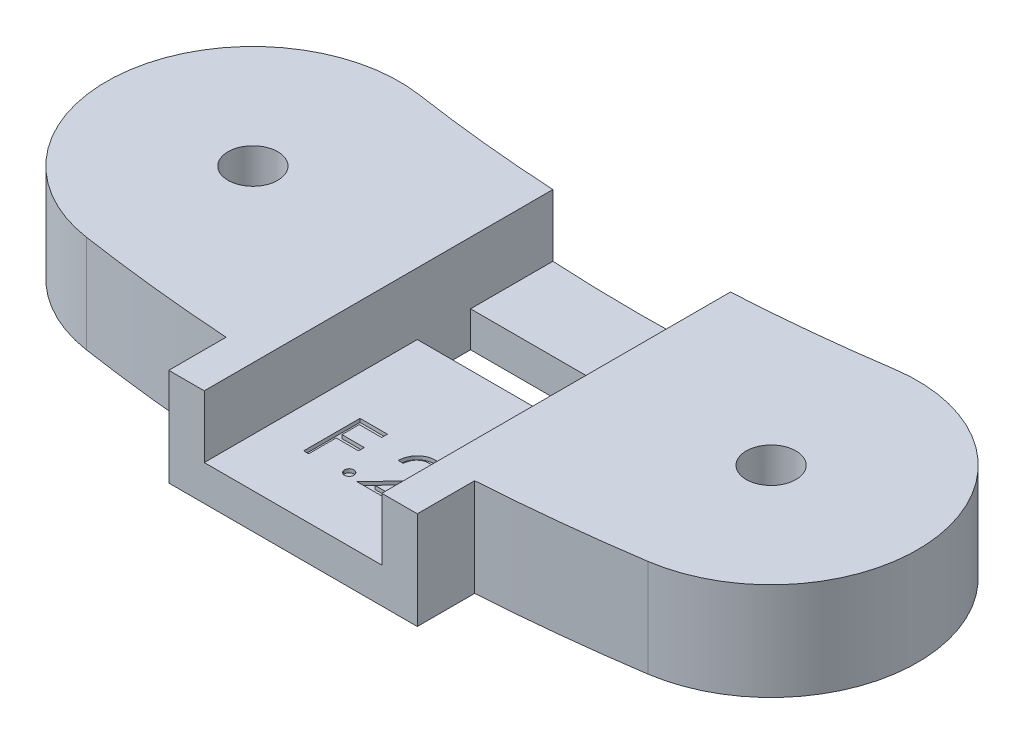
from build123d import *

# Parameters (mm, degrees)
SKETCH2_R                       = 1.4
BOSS_EXTRUDE1_DEPTH             = 14
BOSS_EXTRUDE2_REACH             = 34.049
BOSS_EXTRUDE2_END_RADIUS        = 107
SKETCH3_W                       = 14
SKETCH3_H                       = 14
BOSS_EXTRUDE2_DIRECTION_2_DEPTH = 3
SKETCH19_W                      = 15.846179349
SKETCH19_H                      = 3
CUT_EXTRUDE4_DEPTH              = 22
CUT_EXTRUDE8_DEPTH              = 34.788712692
SKETCH25_W                      = 10
SKETCH25_H                      = 3
CUT_EXTRUDE9_DEPTH              = 2
CUT_EXTRUDE10_DEPTH             = 0.2


with BuildPart() as part:
    # Sketch2 → Boss-Extrude1 (new body)
    with BuildSketch(Plane(origin=(0, 0, 0), x_dir=(1, 0, 0), z_dir=(0, 1, 0))):
        with BuildLine():
            ThreePointArc((-13.376751707, 9.244064366), (0, 8.25), (13.376751707, 9.244064366))
            ThreePointArc((13.376751707, 9.244064366), (22.755560222, 2.304111135), (15.815606991, -7.07469738))
            ThreePointArc((15.815606991, -7.07469738), (0, -8.25), (-15.815606991, -7.07469738))
            ThreePointArc((-15.815606991, -7.07469738), (-22.755560222, 2.304111135), (-13.376751707, 9.244064366))
        make_face()
        with Locations(Location((-14.596179349, 1.084683493, 0), (0, 0, 270))):
            Circle(SKETCH2_R, mode=Mode.SUBTRACT)
        with Locations(Location((14.596179349, 1.084683493, 0), (0, 0, 270))):
            Circle(SKETCH2_R, mode=Mode.SUBTRACT)
    extrude(amount=BOSS_EXTRUDE1_DEPTH)

    # Boss-Extrude2: up to this cylinder (the profile starts outside it)
    boss_extrude2_end = Plane(origin=(0, 7, -98.75), z_dir=(0, -1, 0)) * Cylinder(BOSS_EXTRUDE2_END_RADIUS, 283.098, mode=Mode.PRIVATE)
    # Sketch3 → Boss-Extrude2 (add, up to the surface)
    with BuildSketch(Plane.XY.offset(8.25), mode=Mode.PRIVATE) as boss_extrude2_sk1:
        with Locations((0, 7)):
            Rectangle(SKETCH3_W, SKETCH3_H)
    boss_extrude2_tool1 = extrude(boss_extrude2_sk1.sketch, amount=-BOSS_EXTRUDE2_REACH, mode=Mode.PRIVATE) - boss_extrude2_end
    add(boss_extrude2_tool1.solids().sort_by_distance((0, 7, 8.25))[0])
    add(boss_extrude2_tool1.solids().sort_by_distance((0, 7, 8.25))[1])

    # Sketch3 → Boss-Extrude2 direction 2 (add)
    with BuildSketch(Plane.XY.offset(8.25)):
        with Locations((0, 7)):
            Rectangle(SKETCH3_W, SKETCH3_H)
    extrude(amount=BOSS_EXTRUDE2_DIRECTION_2_DEPTH)

    # Sketch19 → Cut-Extrude4 (cut)
    with BuildSketch(Plane.XY.offset(8.25)):
        with Locations((-14.923089674, 7)):
            Rectangle(SKETCH19_W, SKETCH19_H)
    cut_extrude4 = extrude(amount=-CUT_EXTRUDE4_DEPTH, mode=Mode.SUBTRACT)

    # Mirror2: Cut-Extrude4 across plane
    add(cut_extrude4.mirror(Plane(origin=(0, 0, 0), x_dir=(0, 0, 1), z_dir=(1, 0, 0))), mode=Mode.SUBTRACT)

    # Sketch24 → Cut-Extrude8 (cut, through all)
    with BuildSketch(Plane.XY.offset(11.25)):
        Polygon((-5, 8.5), (-7, 8.5), (-7, 5.5), (-5, 5.5), (-5, 2), (5, 2), (5, 5.5), (7, 5.5), (7, 8.5), (5, 8.5), (5, 12), (-5, 12), align=None)
    extrude(amount=-CUT_EXTRUDE8_DEPTH, mode=Mode.SUBTRACT)


with BuildPart() as cut_extrude8_kept_piece:
    # of the separate pieces the step leaves, the one the design keeps (cut_extrude8_pieces_kept)
    add(part.part.solids().sort_by_distance((15.815606991, 0, 7.07469738))[0])

    # Sketch25 → Cut-Extrude9 (cut)
    with BuildSketch(Plane(origin=(0, 2, 0), x_dir=(1, 0, 0), z_dir=(0, 1, 0))):
        with Locations((0, 2.25)):
            Rectangle(SKETCH25_W, SKETCH25_H)
    extrude(amount=-CUT_EXTRUDE9_DEPTH, mode=Mode.SUBTRACT)

    # Sketch26 → Cut-Extrude10 (cut)
    with BuildSketch(Plane(origin=(0, 2, 0), x_dir=(1, 0, 0), z_dir=(0, 1, 0))):
        Polygon((-2.771713643, -4.706914557), (-1.224918771, -4.706914557), (-1.224918771, -5.032555583), (-2.486777746, -5.032555583), (-2.486777746, -6.00947866), (-1.224918771, -6.00947866), (-1.224918771, -6.335119685), (-2.486777746, -6.335119685), (-2.486777746, -7.881914557), (-2.771713643, -7.881914557), align=None)
        with BuildLine():
            add(Edge.make_bspline(
                [(-0.431168771, -7.393453019), (-0.413488364, -7.394503641), (-0.378827994, -7.396563264), (-0.328718213, -7.410693533), (-0.283365915, -7.435783889), (-0.242968807, -7.469223695), (-0.209670789, -7.509769047), (-0.18368627, -7.554759621), (-0.16967909, -7.605288923), (-0.16763447, -7.640150128), (-0.166585438, -7.658036352)],
                knots=[0, 0, 0, 0, 1.020151414, 1.999887582, 2.974338812, 3.990962822, 5.007586832, 5.987933904, 6.967670073, 8, 8, 8, 8], degree=3))
            add(Edge.make_bspline(
                [(-0.166585438, -7.658036352), (-0.167670019, -7.675492801), (-0.169808796, -7.709916663), (-0.183654162, -7.760064847), (-0.209868822, -7.805083538), (-0.242739137, -7.846179049), (-0.283375901, -7.879689696), (-0.328825433, -7.904566588), (-0.37871036, -7.919708598), (-0.413468739, -7.921637453), (-0.431168771, -7.922619685)],
                knots=[0, 0, 0, 0, 1.009421747, 1.99056486, 2.972319754, 3.999869655, 5.017953583, 5.993804169, 6.978383603, 8, 8, 8, 8], degree=3))
            add(Edge.make_bspline(
                [(-0.431168771, -7.922619685), (-0.448881557, -7.921672994), (-0.483461555, -7.919824803), (-0.533160278, -7.904255686), (-0.5788866, -7.879922976), (-0.619515453, -7.846116565), (-0.652661066, -7.805295007), (-0.677721235, -7.759754806), (-0.69277087, -7.710060216), (-0.69475014, -7.675521076), (-0.695752105, -7.658036352)],
                knots=[0, 0, 0, 0, 1.022052826, 1.995314843, 2.982371812, 4.00089066, 5.028879526, 6.005146991, 6.990147033, 8, 8, 8, 8], degree=3))
            add(Edge.make_bspline(
                [(-0.695752105, -7.658036352), (-0.694788629, -7.640120843), (-0.692907561, -7.605143011), (-0.67768964, -7.555069535), (-0.652855505, -7.509559594), (-0.619286325, -7.469285553), (-0.578896428, -7.435551358), (-0.533270585, -7.410999724), (-0.483341859, -7.396448778), (-0.448861415, -7.394468924), (-0.431168771, -7.393453019)],
                knots=[0, 0, 0, 0, 1.032775665, 2.016367738, 2.991239715, 4.008302682, 5.025365648, 6.011011707, 6.979408107, 8, 8, 8, 8], degree=3))
        make_face()
        with BuildLine():
            Line((0.647517126, -5.683837634), (0.362581229, -5.683837634))
            add(Edge.make_bspline(
                [(0.362581229, -5.683837634), (0.364438289, -5.646036186), (0.368085506, -5.571795148), (0.385165454, -5.463551318), (0.409604678, -5.360087322), (0.444159069, -5.2622339), (0.487072621, -5.16912584), (0.53853486, -5.081132968), (0.599489281, -4.998590961), (0.668619676, -4.922265011), (0.743702656, -4.852244857), (0.824715901, -4.79177903), (0.909846747, -4.740690856), (0.998836916, -4.697981444), (1.092690427, -4.665923155), (1.190555591, -4.642136382), (1.292862379, -4.627824983), (1.362567256, -4.626286663), (1.398017927, -4.625504301)],
                knots=[0, 0, 0, 0, 1.10065271, 2.161652631, 3.183658789, 4.190468796, 5.17591951, 6.163126047, 7.15150782, 8.156236427, 9.156009102, 10.134482811, 11.092018607, 12.041330605, 13.001268258, 13.972401359, 14.968799086, 16, 16, 16, 16], degree=3))
            add(Edge.make_bspline(
                [(1.398017927, -4.625504301), (1.432832323, -4.626319329), (1.501241367, -4.627920831), (1.601083338, -4.64167405), (1.696131312, -4.663214694), (1.7861995, -4.693436536), (1.870569287, -4.734062409), (1.949874478, -4.782864462), (2.025059213, -4.839306738), (2.092738224, -4.905758412), (2.154884839, -4.976699146), (2.208499027, -5.052434601), (2.254412397, -5.130656882), (2.292682649, -5.211962465), (2.320855004, -5.297116898), (2.342243807, -5.384880432), (2.354333675, -5.47616151), (2.356189167, -5.537943886), (2.357132511, -5.569354461)],
                knots=[0, 0, 0, 0, 1.111607364, 2.184268762, 3.212621178, 4.221274766, 5.211760367, 6.196651075, 7.1921475, 8.207485113, 9.220403448, 10.201281604, 11.166441695, 12.114753415, 13.065576456, 14.026450734, 14.996634279, 16, 16, 16, 16], degree=3))
            add(Edge.make_bspline(
                [(2.357132511, -5.569354461), (2.355596479, -5.613575711), (2.352551372, -5.701242191), (2.32650333, -5.830069959), (2.285821138, -5.954886846), (2.236837822, -6.055341399), (2.187423533, -6.136288925), (2.142894151, -6.202935536), (2.090765358, -6.274695497), (2.030278435, -6.35132851), (1.962684615, -6.433434831), (1.887371653, -6.52096486), (1.803802494, -6.613014251), (1.745147997, -6.675884332), (1.714754706, -6.708462033)],
                knots=[0, 0, 0, 0, 1.184426356, 2.348067706, 3.509069118, 4.696110526, 5.333549288, 6.050745305, 6.844228056, 7.710549037, 8.667450064, 9.695053472, 10.805634456, 12, 12, 12, 12], degree=3))
            Line((1.714754706, -6.708462033), (0.920368689, -7.556273532))
            Line((0.920368689, -7.556273532), (2.397837639, -7.556273532))
            Line((2.397837639, -7.556273532), (2.397837639, -7.881914557))
            Line((2.397837639, -7.881914557), (0.240465844, -7.881914557))
            Line((0.240465844, -7.881914557), (1.471795972, -6.567902137))
            add(Edge.make_bspline(
                [(1.471795972, -6.567902137), (1.501775127, -6.536607245), (1.559358947, -6.476496161), (1.64080457, -6.388736476), (1.713955653, -6.307320821), (1.779285716, -6.232403024), (1.835377539, -6.162887244), (1.885154492, -6.101024906), (1.925037564, -6.044097655), (1.968322244, -5.978111527), (2.010244927, -5.897546067), (2.046269707, -5.799090506), (2.068236034, -5.697737927), (2.070871135, -5.629246794), (2.072196613, -5.594795166)],
                knots=[0, 0, 0, 0, 1.329631726, 2.553950428, 3.673215718, 4.687767853, 5.603093632, 6.413772471, 7.123043292, 7.734684054, 8.834405432, 9.900288307, 10.943827018, 12, 12, 12, 12], degree=3))
            add(Edge.make_bspline(
                [(2.072196613, -5.594795166), (2.071619904, -5.573131326), (2.070483321, -5.530436058), (2.06045241, -5.467837976), (2.045293594, -5.407454181), (2.023571824, -5.349098934), (1.994899996, -5.293358949), (1.959999144, -5.240166378), (1.919731015, -5.188741388), (1.873148078, -5.140523753), (1.82197477, -5.096362945), (1.767914273, -5.057243239), (1.710718821, -5.024550617), (1.650629567, -4.997750445), (1.587814034, -4.976727064), (1.52215073, -4.962159638), (1.453821086, -4.953013385), (1.407163558, -4.951775886), (1.383389522, -4.951145326)],
                knots=[0, 0, 0, 0, 0.991446411, 1.95395049, 2.89581595, 3.838931463, 4.798493298, 5.75982156, 6.748411868, 7.785213223, 8.824556874, 9.840280684, 10.836137867, 11.835679398, 12.848801643, 13.863922112, 14.911575587, 16, 16, 16, 16], degree=3))
            add(Edge.make_bspline(
                [(1.383389522, -4.951145326), (1.358560267, -4.951793963), (1.309799709, -4.953067778), (1.238208872, -4.961978337), (1.169913916, -4.977350635), (1.104743047, -4.99837519), (1.042585994, -5.025098302), (0.98374504, -5.058382956), (0.928352276, -5.098100839), (0.876303573, -5.143131915), (0.828348392, -5.193267525), (0.78621444, -5.249156563), (0.749398942, -5.309778575), (0.717277708, -5.374969989), (0.69119219, -5.445322347), (0.671259403, -5.520585908), (0.655487049, -5.600433875), (0.650217891, -5.655574631), (0.647517126, -5.683837634)],
                knots=[0, 0, 0, 0, 1.031018746, 2.02475058, 2.990194455, 3.934040569, 4.864654155, 5.795059489, 6.735614925, 7.690564532, 8.649604399, 9.611025574, 10.590972636, 11.591080095, 12.624614302, 13.701020113, 14.821632451, 16, 16, 16, 16], degree=3))
        make_face()
    extrude(amount=-CUT_EXTRUDE10_DEPTH, mode=Mode.SUBTRACT)


solid = cut_extrude8_kept_piece.part
